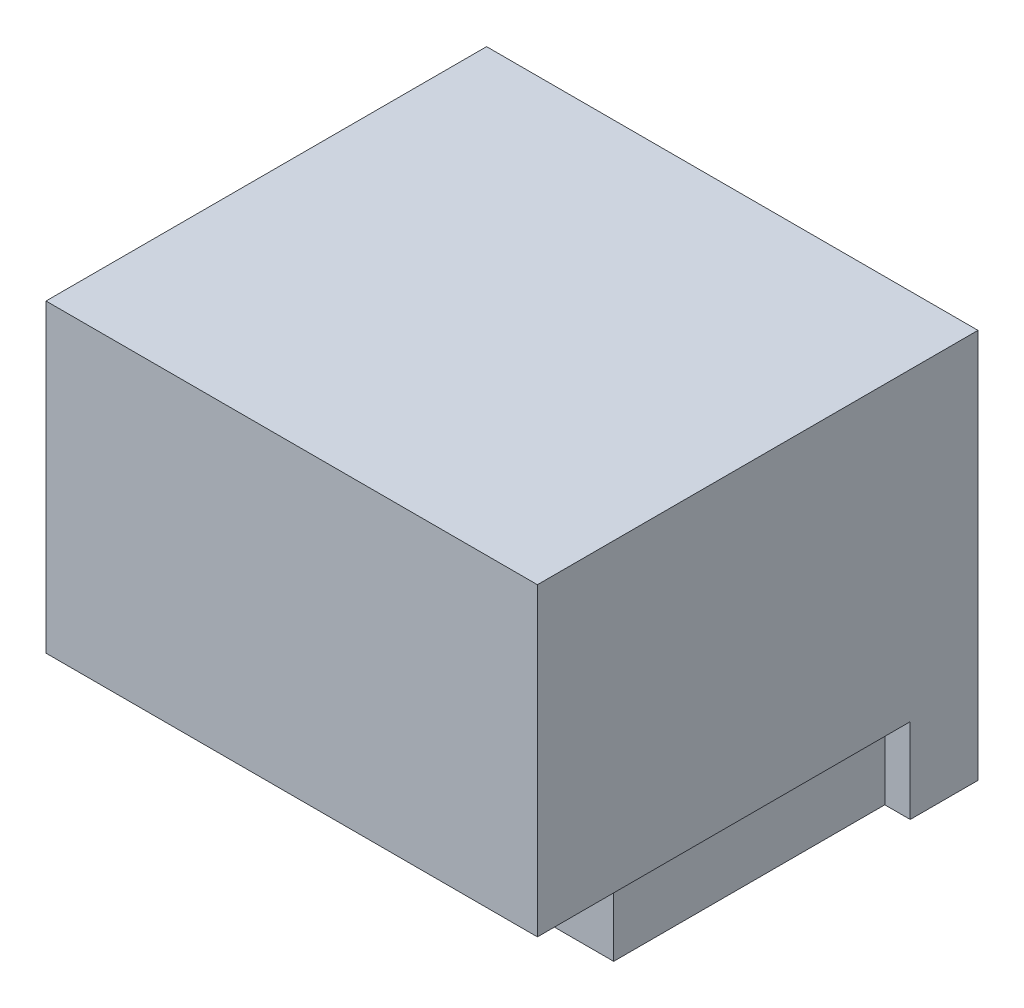
from build123d import *

# Parameters (mm, degrees)
SKETCH_1_W          = 14.5
SKETCH_1_H          = 13
EXTRUDE_1_DEPTH     = 9
EXTRUDE_2_DEPTH     = 2.5
SKETCH_3_W          = 12
SKETCH_3_H          = 7
CUT_EXTRUDE_1_DEPTH = 9.7
CUT_EXTRUDE_2_DEPTH = 6.5
SKETCH_5_W          = 7.522723779
SKETCH_5_H          = 5
CUT_EXTRUDE_3_DEPTH = 6.5
SKETCH_6_W          = 1
SKETCH_6_H          = 8
CUT_EXTRUDE_4_DEPTH = 1


with BuildPart() as part:
    # 草图1 → 凸台-拉伸1 (new body)
    with BuildSketch(Plane(origin=(0, 0, 0), x_dir=(1, 0, 0), z_dir=(0, 1, 0))):
        with Locations((1.514240506, -0.993670886)):
            Rectangle(SKETCH_1_W, SKETCH_1_H)
    extrude(amount=EXTRUDE_1_DEPTH)

    # 草图2 → 凸台-拉伸2 (add)
    with BuildSketch(Plane.XZ):
        Polygon((-5.735759494, -3.506329114), (-5.735759494, -5.506329114), (8.764240506, -5.506329114), (8.764240506, -3.506329114), (8.014240506, -3.506329114), (8.014240506, 4.493670886), (-4.985759494, 4.493670886), (-4.985759494, -3.506329114), align=None)
    extrude(amount=EXTRUDE_2_DEPTH)

    # 草图3 → 切除-拉伸1 (cut)
    with BuildSketch(Plane(origin=(0, 0, -5.506329114), x_dir=(-1, 0, 0), z_dir=(0, 0, -1))):
        with Locations((-1.514240506, 3.5)):
            Rectangle(SKETCH_3_W, SKETCH_3_H)
    extrude(amount=-CUT_EXTRUDE_1_DEPTH, mode=Mode.SUBTRACT)

    # 草图4 → 切除-拉伸2 (cut)
    with BuildSketch(Plane(origin=(0, 0, -5.506329114), x_dir=(-1, 0, 0), z_dir=(0, 0, -1))):
        Polygon((-4.514240506, 0), (1.485759494, 0), (1.485759494, -1.5), (0.235759494, -1.5), (0.235759494, -2.5), (-3.264240506, -2.5), (-3.264240506, -1.5), (-4.514240506, -1.5), align=None)
    extrude(amount=-CUT_EXTRUDE_2_DEPTH, mode=Mode.SUBTRACT)

    # 草图5 → 切除-拉伸3 (cut)
    with BuildSketch(Plane.XZ.offset(2.5)):
        with Locations((1.514240506, -1.506329114)):
            Rectangle(SKETCH_5_W, SKETCH_5_H)
    extrude(amount=-CUT_EXTRUDE_3_DEPTH, mode=Mode.SUBTRACT)

    # 草图6 → 切除-拉伸4 (cut)
    with BuildSketch(Plane.XZ.offset(2.5)):
        with Locations((-3.615759494, -0.375358935)):
            Rectangle(SKETCH_6_W, SKETCH_6_H)
        with Locations((6.644240506, -0.375358935)):
            Rectangle(SKETCH_6_W, SKETCH_6_H)
    extrude(amount=-CUT_EXTRUDE_4_DEPTH, mode=Mode.SUBTRACT)


solid = part.part
